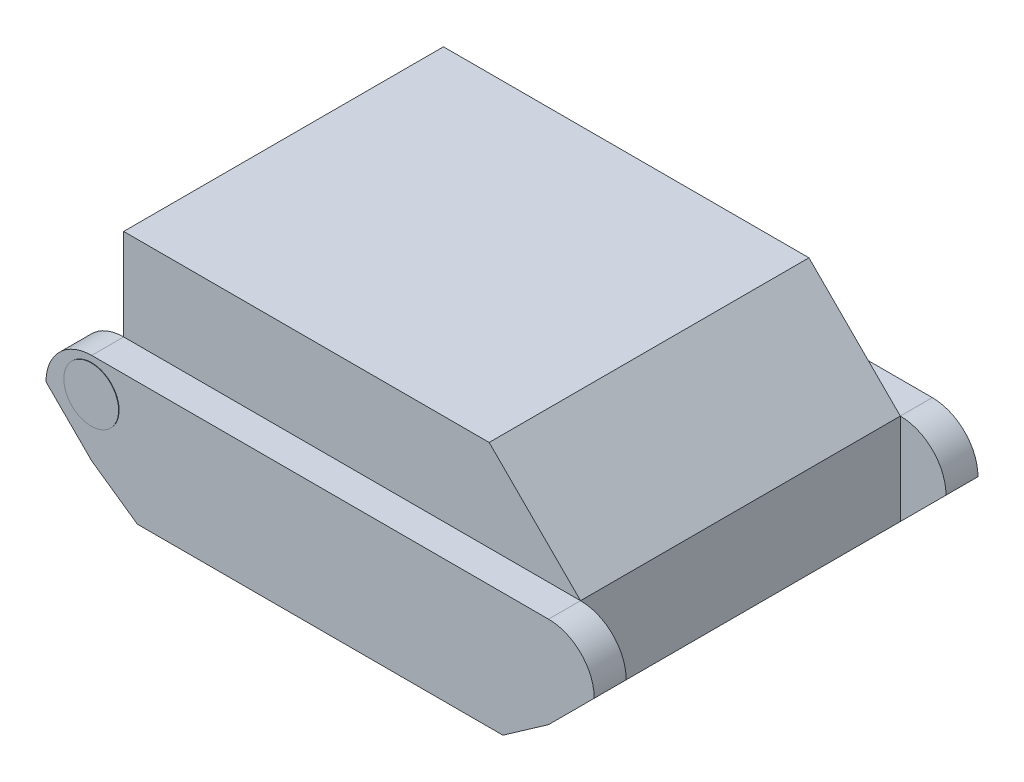
from build123d import *

# Parameters (mm, degrees)
ESQUISSE1_W                  = 100
ESQUISSE1_H                  = 40
BOSS_EXTRU_3_DEPTH           = 70
ENL_V_MAT_EXTRU_1_DEPTH      = 92.8886174
ENL_V_MAT_EXTRU_1_DEPTH_BACK = 92.8886174
BOSS_EXTRU_5_DEPTH           = 7
BOSS_EXTRU_6_START           = 7
ESQUISSE4_W                  = 80
ESQUISSE4_H                  = 7
BOSS_EXTRU_6_DEPTH           = 7
BOSS_EXTRU_7_DEPTH           = 0.1


with BuildPart() as part:
    # Esquisse1 → Boss.-Extru.3 (new body)
    with BuildSketch(Plane.XY):
        with Locations((-2.858975564, 7.376024363)):
            Rectangle(ESQUISSE1_W, ESQUISSE1_H)
    extrude(amount=BOSS_EXTRU_3_DEPTH)

    # Esquisse2 → Enlèv. mat.-Extru.1 (cut, two sides: drawn at the far end of the back side and taken through both)
    with BuildSketch(Plane.XY.offset(70).offset(-ENL_V_MAT_EXTRU_1_DEPTH_BACK)):
        Polygon((-124.152094394, 178.669143194), (27.141024436, 27.376024363), (47.141024436, 7.376024363), (198.434143267, -143.917094467), (501.020380927, 158.669143194), (178.434143267, 481.255380855), align=None)
    extrude(amount=ENL_V_MAT_EXTRU_1_DEPTH + ENL_V_MAT_EXTRU_1_DEPTH_BACK, mode=Mode.SUBTRACT)

    # Esquisse3 → Boss.-Extru.5 (add)
    with BuildSketch(Plane(origin=(0, 0, 0), x_dir=(-1, 0, 0), z_dir=(0, 0, -1))):
        with BuildLine():
            Line((-57.141024436, -2.623975637), (-47.141024436, -12.623975637))
            Line((-47.141024436, -12.623975637), (-37.141024436, -19.623975637))
            Line((-37.141024436, -19.623975637), (42.858975564, -19.623975637))
            Line((42.858975564, -19.623975637), (52.858975564, -12.623975637))
            Line((52.858975564, -12.623975637), (62.858975564, -2.623975637))
            ThreePointArc((62.858975564, -2.623975637), (59.930043376, 4.447092175), (52.858975564, 7.376024363))
            Line((52.858975564, 7.376024363), (-47.141024436, 7.376024363))
            ThreePointArc((-47.141024436, 7.376024363), (-54.212092248, 4.447092175), (-57.141024436, -2.623975637))
        make_face()
    extrude(amount=BOSS_EXTRU_5_DEPTH)

    # Esquisse4 → Boss.-Extru.6 (add)
    with BuildSketch(Plane.XY.offset(70).offset(BOSS_EXTRU_6_START)):
        with BuildLine():
            ThreePointArc((47.141024436, 7.376024363), (54.212092248, 4.447092175), (57.141024436, -2.623975637))
            Line((57.141024436, -2.623975637), (47.141024436, -12.623975637))
            Line((47.141024436, -12.623975637), (47.141024436, 7.376024363))
        make_face()
        Polygon((47.141024436, 7.376024363), (-52.858975564, 7.376024363), (-52.858975564, -12.623975637), (-42.858975564, -12.623975637), (37.141024436, -12.623975637), (47.141024436, -12.623975637), align=None)
        Polygon((37.141024436, -19.623975637), (47.141024436, -12.623975637), (37.141024436, -12.623975637), align=None)
        with Locations((-2.858975564, -16.123975637)):
            Rectangle(ESQUISSE4_W, ESQUISSE4_H)
        Polygon((-42.858975564, -12.623975637), (-52.858975564, -12.623975637), (-42.858975564, -19.623975637), align=None)
        with BuildLine():
            Line((-52.858975564, -12.623975637), (-52.858975564, 7.376024363))
            ThreePointArc((-52.858975564, 7.376024363), (-59.930043376, 4.447092175), (-62.858975564, -2.623975637))
            Line((-62.858975564, -2.623975637), (-52.858975564, -12.623975637))
        make_face()
    extrude(amount=-BOSS_EXTRU_6_DEPTH)

    # Esquisse5 → Boss.-Extru.7 (add)
    with BuildSketch(Plane.XY.offset(77)):
        with BuildLine():
            ThreePointArc((-52.858975564, 5.997782361), (-58.856757925, 0), (-52.858975564, -5.997782361))
            Line((-52.858975564, -5.997782361), (-52.858975564, 5.997782361))
        make_face()
        with BuildLine():
            Line((-52.858975564, 5.997782361), (-52.858975564, -5.997782361))
            ThreePointArc((-52.858975564, -5.997782361), (-48.617902985, -4.241072579), (-46.861193203, 0))
            ThreePointArc((-46.861193203, 0), (-48.617902985, 4.241072579), (-52.858975564, 5.997782361))
        make_face()
    extrude(amount=BOSS_EXTRU_7_DEPTH)


solid = part.part
